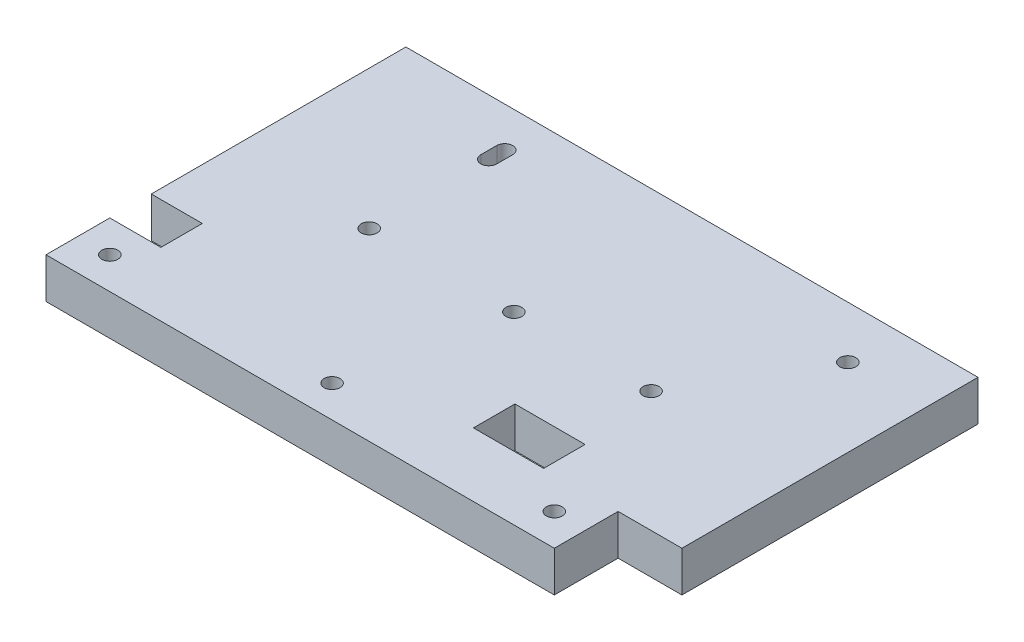
from build123d import *

# Parameters (mm, degrees)
SKETCH1_R           = 2.5
SKETCH1_W           = 22
SKETCH1_H           = 13
BOSS_EXTRUDE1_DEPTH = 6.35


with BuildPart() as part:
    # Sketch1 → Boss-Extrude1 (new, symmetric)
    with BuildSketch(Plane(origin=(0, 0, 0), x_dir=(1, 0, 0), z_dir=(0, 1, 0))):
        Polygon((0, 0), (159.35, 0), (159.35, 20), (179.35, 20), (179.35, 112.82), (0, 112.82), (0, 33), (16, 33), (16, 20), (0, 20), align=None)
        with Locations(Location((43.48717527, 57.82, 0), (0, 0, 270))):
            Circle(SKETCH1_R, mode=Mode.SUBTRACT)
        with Locations(Location((88.86282473, 57.82, 0), (0, 0, 270))):
            Circle(SKETCH1_R, mode=Mode.SUBTRACT)
        with Locations(Location((131.86282473, 57.82, 0), (0, 0, 270))):
            Circle(SKETCH1_R, mode=Mode.SUBTRACT)
        with Locations(Location((154.85, 96.505782571, 0), (0, 0, 270))):
            Circle(SKETCH1_R, mode=Mode.SUBTRACT)
        with Locations(Location((10, 10, 0), (0, 0, 270))):
            Circle(SKETCH1_R, mode=Mode.SUBTRACT)
        with Locations(Location((79.675, 10, 0), (0, 0, 270))):
            Circle(SKETCH1_R, mode=Mode.SUBTRACT)
        with Locations(Location((149.35, 10, 0), (0, 0, 270))):
            Circle(SKETCH1_R, mode=Mode.SUBTRACT)
        with BuildLine():
            Line((40.98717527, 95.32), (40.98717527, 100.32))
            ThreePointArc((40.98717527, 100.32), (43.48717527, 102.82), (45.98717527, 100.32))
            Line((45.98717527, 100.32), (45.98717527, 95.32))
            ThreePointArc((45.98717527, 95.32), (43.48717527, 92.82), (40.98717527, 95.32))
        make_face(mode=Mode.SUBTRACT)
        with Locations((125, 26.5)):
            Rectangle(SKETCH1_W, SKETCH1_H, mode=Mode.SUBTRACT)
    extrude(amount=BOSS_EXTRUDE1_DEPTH, both=True)


solid = part.part
